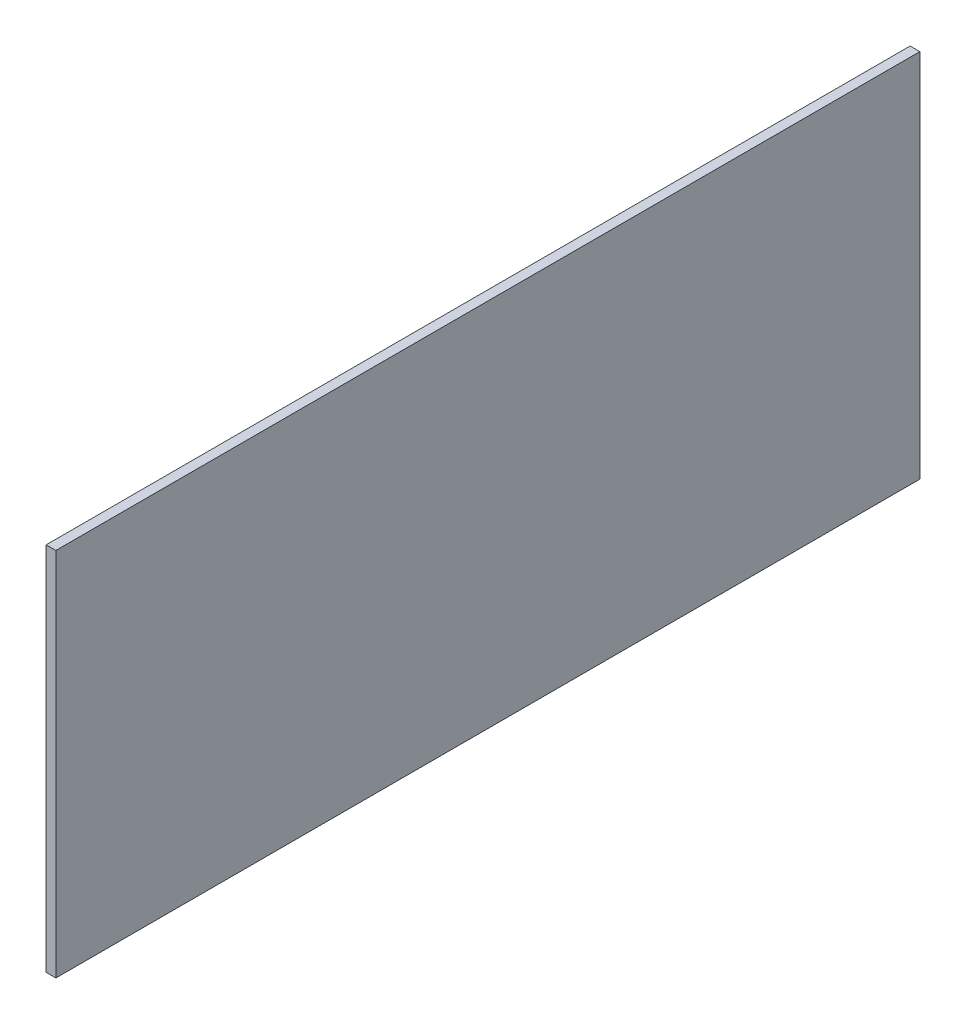
from build123d import *

# Parameters (mm, degrees)
SKETCH1_W           = 177.8
SKETCH1_H           = 76.2
BOSS_EXTRUDE1_DEPTH = 2.000000064


with BuildPart() as part:
    # Sketch1 → Boss-Extrude1 (new body)
    with BuildSketch(Plane(origin=(0, 0, 0), x_dir=(0, 0, -1), z_dir=(1, 0, 0))):
        Rectangle(SKETCH1_W, SKETCH1_H)
    extrude(amount=BOSS_EXTRUDE1_DEPTH)


solid = part.part
